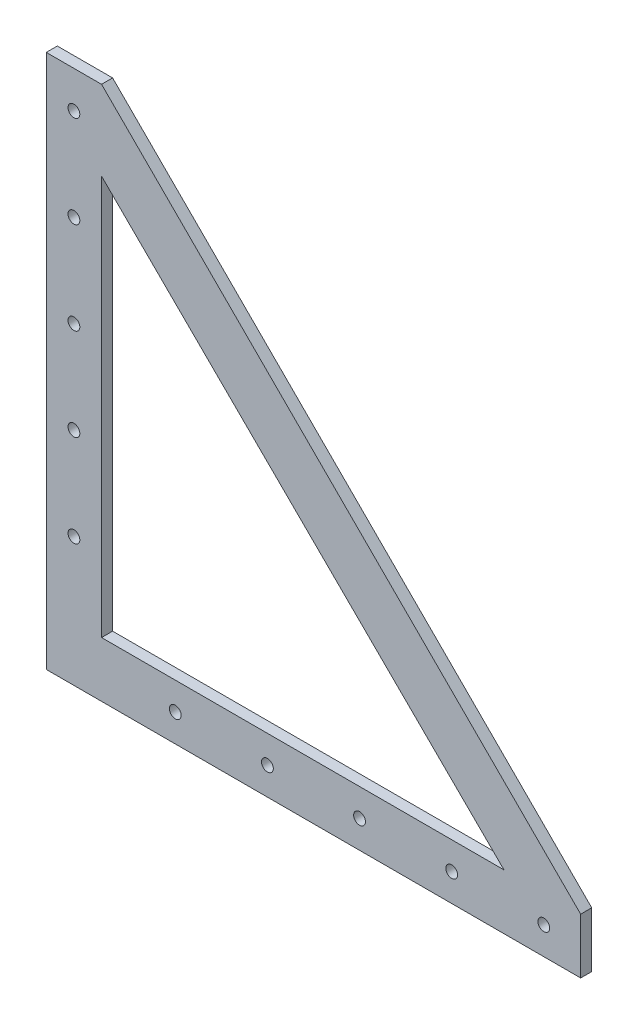
from build123d import *

# Parameters (mm, degrees)
SKETCH1_R           = 1.6
BOSS_EXTRUDE1_DEPTH = 3


with BuildPart() as part:
    # Sketch1 → Boss-Extrude1 (new body)
    with BuildSketch(Plane.XY):
        Polygon((0, 145), (0, 0), (145, 0), (145, 15), (15, 145), align=None)
        with Locations((135, 7.5)):
            Circle(SKETCH1_R, mode=Mode.SUBTRACT)
        with Locations((110, 7.5)):
            Circle(SKETCH1_R, mode=Mode.SUBTRACT)
        with Locations((85, 7.5)):
            Circle(SKETCH1_R, mode=Mode.SUBTRACT)
        with Locations((60, 7.5)):
            Circle(SKETCH1_R, mode=Mode.SUBTRACT)
        with Locations((35, 7.5)):
            Circle(SKETCH1_R, mode=Mode.SUBTRACT)
        with Locations((7.5, 135)):
            Circle(SKETCH1_R, mode=Mode.SUBTRACT)
        with Locations((7.5, 110)):
            Circle(SKETCH1_R, mode=Mode.SUBTRACT)
        with Locations((7.5, 85)):
            Circle(SKETCH1_R, mode=Mode.SUBTRACT)
        with Locations((7.5, 60)):
            Circle(SKETCH1_R, mode=Mode.SUBTRACT)
        with Locations((7.5, 35)):
            Circle(SKETCH1_R, mode=Mode.SUBTRACT)
        Polygon((15, 123.418535773), (15, 15), (124.2033211, 15), align=None, mode=Mode.SUBTRACT)
    extrude(amount=BOSS_EXTRUDE1_DEPTH)


solid = part.part
